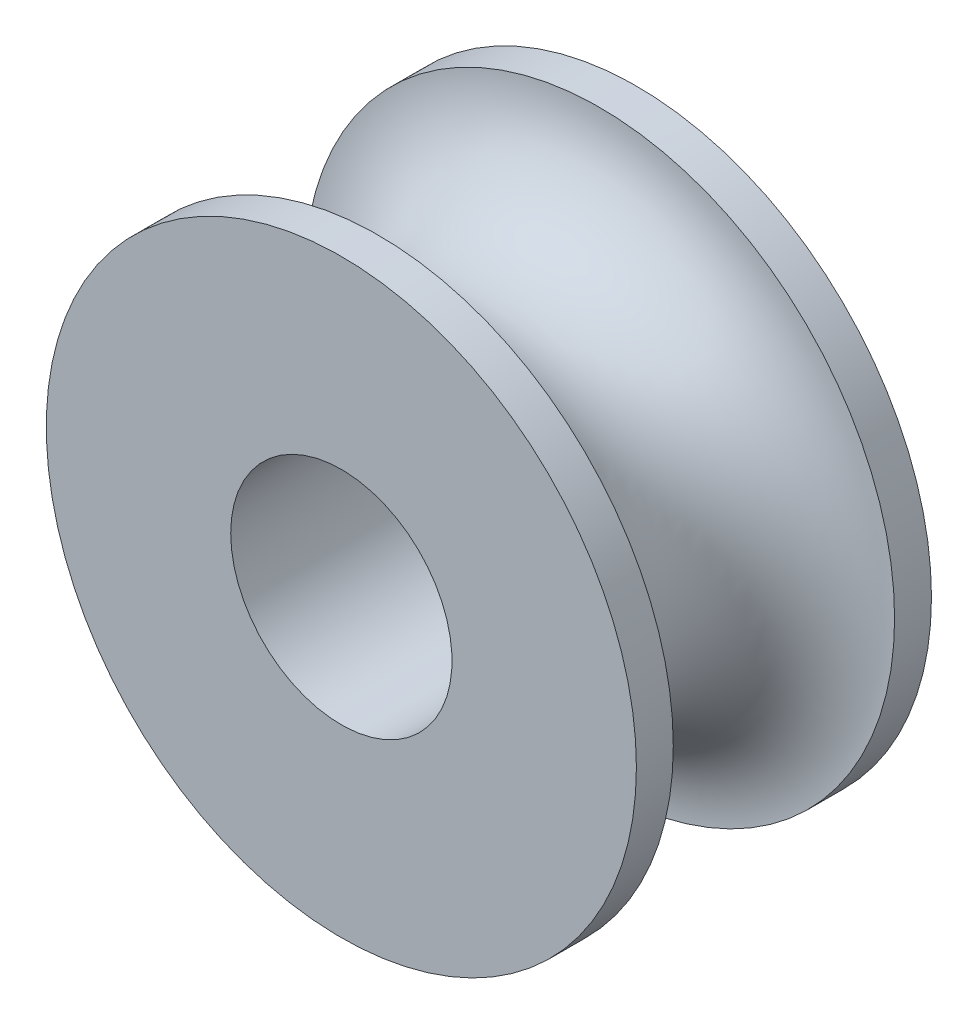
from build123d import *

# Parameters (mm, degrees)
SKETCH1_R           = 25.4
BOSS_EXTRUDE1_DEPTH = 25.4
SKETCH3_R           = 9.525
CUT_EXTRUDE1_DEPTH  = 25.4


with BuildPart() as part:
    # Sketch1 → Boss-Extrude1 (new body)
    with BuildSketch(Plane.XY):
        Circle(SKETCH1_R)
    extrude(amount=BOSS_EXTRUDE1_DEPTH)

    # Sketch2 → Cut-Revolve1 (revolve, cut)
    with BuildSketch(Plane(origin=(0, 0, 0), x_dir=(1, 0, 0), z_dir=(0, 1, 0))):
        with BuildLine():
            Line((25.4, -22.225), (25.4, -3.175))
            ThreePointArc((25.4, -3.175), (15.875, -12.7), (25.4, -22.225))
        make_face()
    revolve(axis=Axis((0, 0, 32.071065699), (0, 0, -1)), mode=Mode.SUBTRACT)

    # Sketch3 → Cut-Extrude1 (cut)
    with BuildSketch(Plane(origin=(0, 0, 0), x_dir=(-1, 0, 0), z_dir=(0, 0, -1))):
        Circle(SKETCH3_R)
    extrude(amount=-CUT_EXTRUDE1_DEPTH, mode=Mode.SUBTRACT)


solid = part.part
